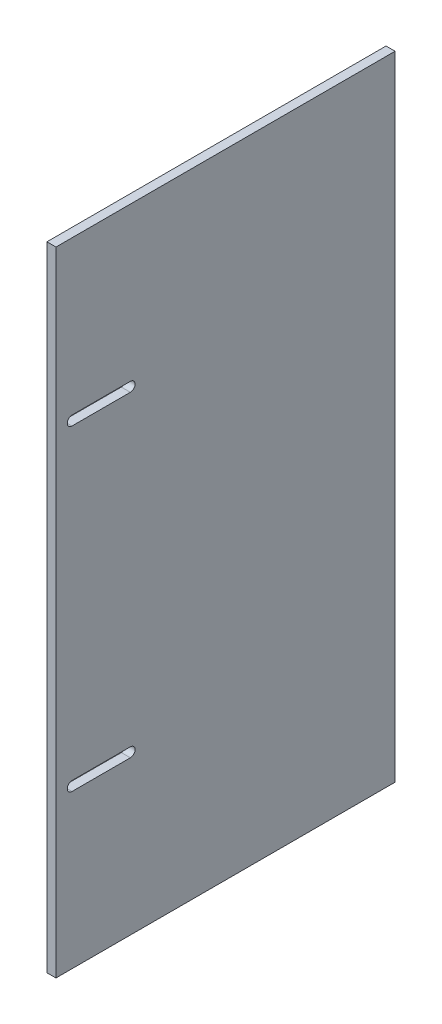
from build123d import *

# Parameters (mm, degrees)
SKETCH1_W           = 280
SKETCH1_H           = 150
BOSS_EXTRUDE1_DEPTH = 4


with BuildPart() as part:
    # Sketch1 → Boss-Extrude1 (new body)
    with BuildSketch(Plane.YZ):
        with Locations((140, 75)):
            Rectangle(SKETCH1_W, SKETCH1_H)
        with BuildLine():
            Line((67.9, 142.9), (67.9, 117.1))
            ThreePointArc((67.9, 117.1), (70, 115), (72.1, 117.1))
            Line((72.1, 117.1), (72.1, 142.9))
            ThreePointArc((72.1, 142.9), (70, 145), (67.9, 142.9))
        make_face(mode=Mode.SUBTRACT)
        with BuildLine():
            Line((212.1, 142.9), (212.1, 117.1))
            ThreePointArc((212.1, 117.1), (210, 115), (207.9, 117.1))
            Line((207.9, 117.1), (207.9, 142.9))
            ThreePointArc((207.9, 142.9), (210, 145), (212.1, 142.9))
        make_face(mode=Mode.SUBTRACT)
    extrude(amount=BOSS_EXTRUDE1_DEPTH)


solid = part.part
